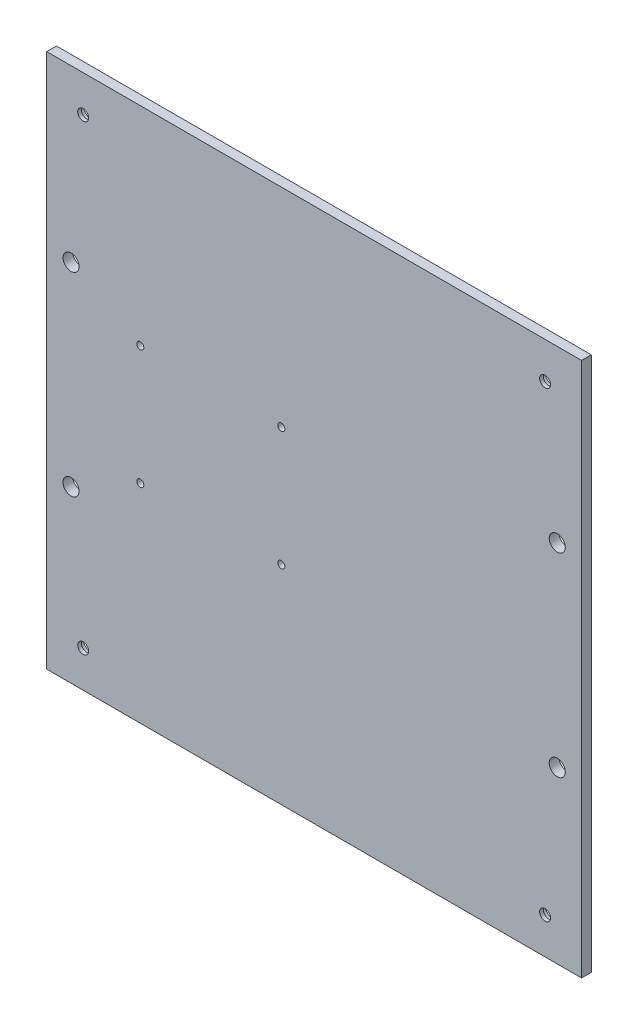
from build123d import *

# Parameters (mm, degrees)
FONDO_START                   = -54
SK_FONDO_W                    = 220
SK_FONDO_H                    = 220
FONDO_DEPTH                   = 4
PASANTES_M4_SEPARADORES_START = -54
SK_PASANTES_M4_SEPARADORES_R  = 2.25
PASANTES_M4_SEPARADORES_DEPTH = 4
AVELLANADO_M4_START           = -54
SK_AVELLANADO_M4_R            = 4.2
AVELLANADO_M4_DEPTH           = 2.5
PASANTES_M2_5_RPI_START       = -54
SK_PASANTES_M2_5_RPI_R        = 1.45
PASANTES_M2_5_RPI_DEPTH       = 4
AVELLANADO_M2_5_START         = -54
SK_AVELLANADO_M2_5_R          = 2.5
AVELLANADO_M2_5_DEPTH         = 1.5
AGUJEROS_ANCLAJE_START        = -54
SK_AGUJEROS_ANCLAJE_R         = 3.3
AGUJEROS_ANCLAJE_DEPTH        = 4


with BuildPart() as part:
    # Sk_Fondo → Fondo (new body)
    with BuildSketch(Plane.XY.offset(FONDO_START)):
        Rectangle(SK_FONDO_W, SK_FONDO_H)
    extrude(amount=FONDO_DEPTH)

    # Sk_Pasantes_M4_separadores → Pasantes_M4_separadores (cut)
    with BuildSketch(Plane.XY.offset(PASANTES_M4_SEPARADORES_START)):
        with Locations((-95, -95)):
            Circle(SK_PASANTES_M4_SEPARADORES_R)
        with Locations((-95, 95)):
            Circle(SK_PASANTES_M4_SEPARADORES_R)
        with Locations((95, -95)):
            Circle(SK_PASANTES_M4_SEPARADORES_R)
        with Locations((95, 95)):
            Circle(SK_PASANTES_M4_SEPARADORES_R)
    extrude(amount=PASANTES_M4_SEPARADORES_DEPTH, mode=Mode.SUBTRACT)

    # Sk_Avellanado_M4 → Avellanado_M4 (cut)
    with BuildSketch(Plane.XY.offset(AVELLANADO_M4_START)):
        with Locations((-95, -95)):
            Circle(SK_AVELLANADO_M4_R)
        with Locations((-95, 95)):
            Circle(SK_AVELLANADO_M4_R)
        with Locations((95, -95)):
            Circle(SK_AVELLANADO_M4_R)
        with Locations((95, 95)):
            Circle(SK_AVELLANADO_M4_R)
    extrude(amount=AVELLANADO_M4_DEPTH, mode=Mode.SUBTRACT)

    # Sk_Pasantes_M2-5_RPi → Pasantes_M2-5_RPi (cut)
    with BuildSketch(Plane.XY.offset(PASANTES_M2_5_RPI_START)):
        with Locations((-13.5, -24.5)):
            Circle(SK_PASANTES_M2_5_RPI_R)
        with Locations((-13.5, 24.5)):
            Circle(SK_PASANTES_M2_5_RPI_R)
        with Locations((-71.5, -24.5)):
            Circle(SK_PASANTES_M2_5_RPI_R)
        with Locations((-71.5, 24.5)):
            Circle(SK_PASANTES_M2_5_RPI_R)
    extrude(amount=PASANTES_M2_5_RPI_DEPTH, mode=Mode.SUBTRACT)

    # Sk_Avellanado_M2-5 → Avellanado_M2-5 (cut)
    with BuildSketch(Plane.XY.offset(AVELLANADO_M2_5_START)):
        with Locations((-13.5, -24.5)):
            Circle(SK_AVELLANADO_M2_5_R)
        with Locations((-13.5, 24.5)):
            Circle(SK_AVELLANADO_M2_5_R)
        with Locations((-71.5, -24.5)):
            Circle(SK_AVELLANADO_M2_5_R)
        with Locations((-71.5, 24.5)):
            Circle(SK_AVELLANADO_M2_5_R)
    extrude(amount=AVELLANADO_M2_5_DEPTH, mode=Mode.SUBTRACT)

    # Sk_Agujeros_anclaje → Agujeros_anclaje (cut)
    with BuildSketch(Plane.XY.offset(AGUJEROS_ANCLAJE_START)):
        with Locations((-100, -40)):
            Circle(SK_AGUJEROS_ANCLAJE_R)
        with Locations((-100, 40)):
            Circle(SK_AGUJEROS_ANCLAJE_R)
        with Locations((100, -40)):
            Circle(SK_AGUJEROS_ANCLAJE_R)
        with Locations((100, 40)):
            Circle(SK_AGUJEROS_ANCLAJE_R)
    extrude(amount=AGUJEROS_ANCLAJE_DEPTH, mode=Mode.SUBTRACT)


solid = part.part
